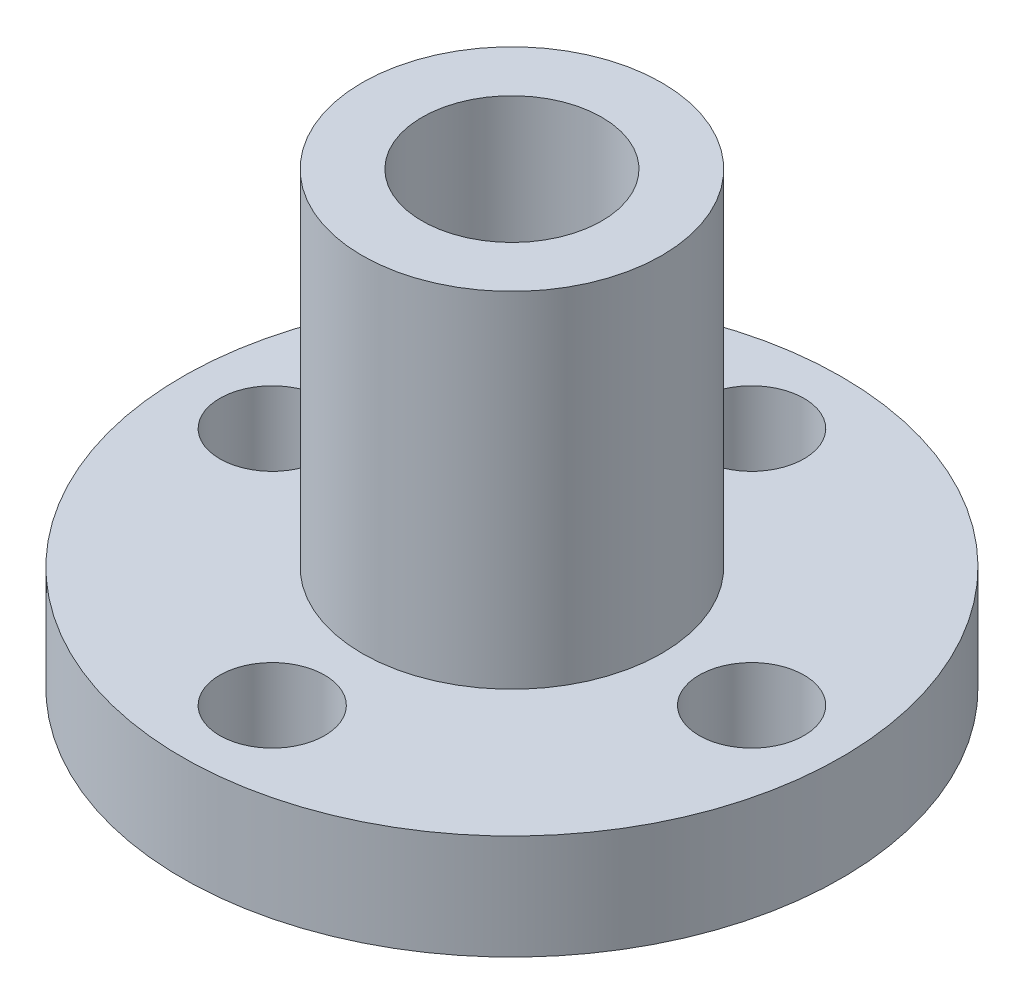
from build123d import *

# Parameters (mm, degrees)
SKETCH2_R          = 1.75
CUT_EXTRUDE1_DEPTH = 10


with BuildPart() as part:
    # Sketch1 → Revolve1 (revolve)
    with BuildSketch(Plane.XY, mode=Mode.PRIVATE) as revolve1_sk:
        Polygon((-5, 15), (-5, 3.5), (-11, 3.5), (-11, 0), (-3, 0), (-3, 15), align=None)
    revolve(revolve1_sk.sketch.rotate(Axis((0, 0, 0), (0, 1, 0)), 270), axis=Axis((0, 0, 0), (0, 1, 0)))

    # Sketch2 → Cut-Extrude1 (cut)
    with BuildSketch(Plane(origin=(0, 3.5, 0), x_dir=(1, 0, 0), z_dir=(0, 1, 0))):
        with Locations(Location((0, 8, 0), (0, 0, 270))):
            Circle(SKETCH2_R)
        with Locations(Location((8, 0, 0), (0, 0, 270))):
            Circle(SKETCH2_R)
        with Locations(Location((0, -8, 0), (0, 0, 270))):
            Circle(SKETCH2_R)
        with Locations(Location((-8, 0, 0), (0, 0, 270))):
            Circle(SKETCH2_R)
    extrude(amount=-CUT_EXTRUDE1_DEPTH, mode=Mode.SUBTRACT)


solid = part.part
